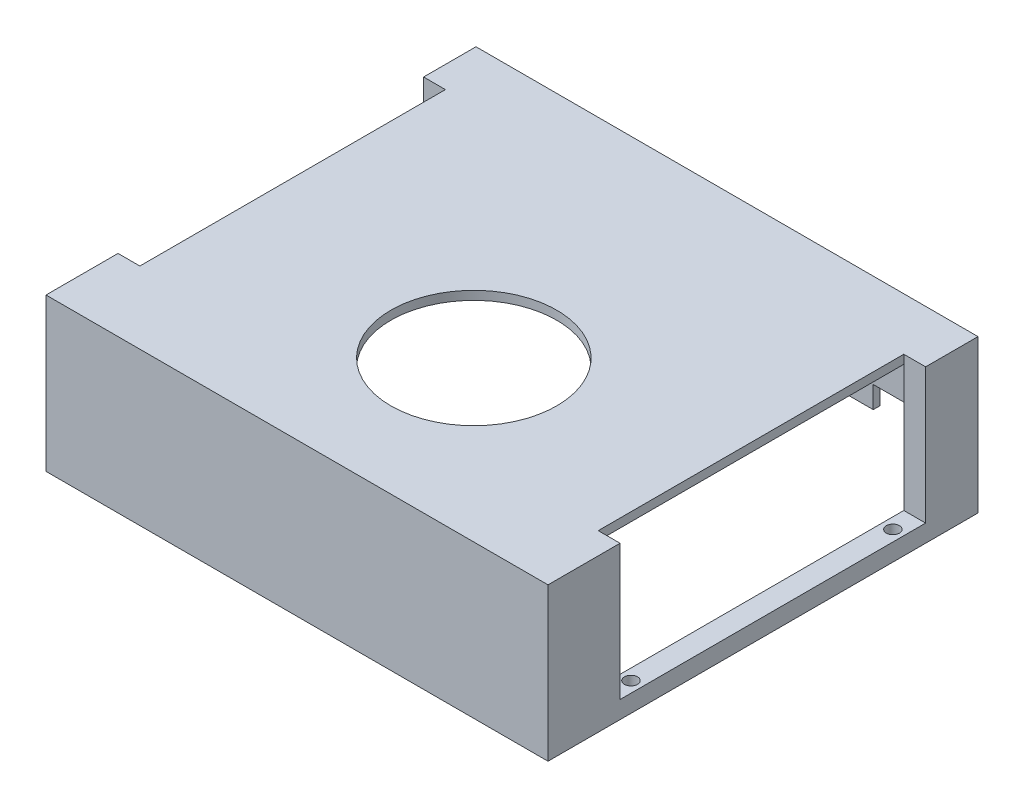
from build123d import *

# Parameters (mm, degrees)
SKETCH_1_W          = 115
SKETCH_1_H          = 98.5
EXTRUDE_1_DEPTH     = 35
SKETCH_2_W          = 105
SKETCH_2_H          = 92
CUT_EXTRUDE_1_DEPTH = 33
SKETCH_4_R          = 1.5
CUT_EXTRUDE_2_DEPTH = 3
SKETCH_4_2_R        = 1.5
CUT_EXTRUDE_3_DEPTH = 4
SKETCH_5_W          = 5
SKETCH_5_H          = 70
CUT_EXTRUDE_4_DEPTH = 31
SKETCH_6_R          = 19
CUT_EXTRUDE_5_DEPTH = 2
CUT_EXTRUDE_6_DEPTH = 2
SKETCH_6_3_R        = 19
EXTRUDE_2_DEPTH     = 2
SKETCH_6_5_R        = 19
CUT_EXTRUDE_7_DEPTH = 2


with BuildPart() as part:
    # 草图1 → 凸台-拉伸1 (new body)
    with BuildSketch(Plane(origin=(0, 0, 0), x_dir=(1, 0, 0), z_dir=(0, 1, 0))):
        with Locations((0, 7.75)):
            Rectangle(SKETCH_1_W, SKETCH_1_H)
    extrude(amount=EXTRUDE_1_DEPTH)

    # 草图2 → 切除-拉伸1 (cut)
    with BuildSketch(Plane.XZ):
        with Locations((0, -9.5)):
            Rectangle(SKETCH_2_W, SKETCH_2_H)
    extrude(amount=-CUT_EXTRUDE_1_DEPTH, mode=Mode.SUBTRACT)

    # 草图4 → 切除-拉伸2 (cut)
    with BuildSketch(Plane(origin=(0, 0, 0), x_dir=(-1, 0, 0), z_dir=(0, -1, 0))):
        with Locations((55, -20)):
            Circle(SKETCH_4_R)
        with Locations((55, 40)):
            Circle(SKETCH_4_R)
        with Locations((-55, -20)):
            Circle(SKETCH_4_R)
        with Locations((-55, 40)):
            Circle(SKETCH_4_R)
    extrude(amount=-CUT_EXTRUDE_2_DEPTH, mode=Mode.SUBTRACT)

    # 草图4<2> → 切除-拉伸3 (cut)
    with BuildSketch(Plane(origin=(0, 0, 0), x_dir=(-1, 0, 0), z_dir=(0, -1, 0))):
        with Locations((55, -20)):
            Circle(SKETCH_4_2_R)
        with Locations((55, 40)):
            Circle(SKETCH_4_2_R)
        with Locations((-55, -20)):
            Circle(SKETCH_4_2_R)
        with Locations((-55, 40)):
            Circle(SKETCH_4_2_R)
    extrude(amount=-CUT_EXTRUDE_3_DEPTH, mode=Mode.SUBTRACT)

    # 草图5 → 切除-拉伸4 (cut)
    with BuildSketch(Plane(origin=(0, 35, 0), x_dir=(1, 0, 0), z_dir=(0, 1, 0))):
        with Locations((-55, 10)):
            Rectangle(SKETCH_5_W, SKETCH_5_H)
        with Locations((55, 10)):
            Rectangle(SKETCH_5_W, SKETCH_5_H)
    extrude(amount=-CUT_EXTRUDE_4_DEPTH, mode=Mode.SUBTRACT)

    # 草图6 → 切除-拉伸5 (cut)
    with BuildSketch(Plane(origin=(0, 35, 0), x_dir=(1, 0, 0), z_dir=(0, 1, 0))):
        with Locations((4, -5)):
            Circle(SKETCH_6_R)
    extrude(amount=-CUT_EXTRUDE_5_DEPTH, mode=Mode.SUBTRACT)

    # 草图7 → 切除-拉伸6 (cut)
    with BuildSketch(Plane(origin=(0, 0, -57), x_dir=(-1, 0, 0), z_dir=(0, 0, -1))):
        Polygon((-50, 0), (50, 0), (50, 10), (36, 10), (36, 20), (-15, 20), (-15, 10), (-35, 10), (-35, 15), (-50, 15), (-50, 10), align=None)
    extrude(amount=-CUT_EXTRUDE_6_DEPTH, mode=Mode.SUBTRACT)

    # 草图6<3> → 凸台-拉伸2 (add)
    with BuildSketch(Plane(origin=(0, 35, 0), x_dir=(1, 0, 0), z_dir=(0, 1, 0))):
        with Locations((4, -5)):
            Circle(SKETCH_6_3_R)
    extrude(amount=-EXTRUDE_2_DEPTH)

    # 草图6<5> → 切除-拉伸7 (cut)
    with BuildSketch(Plane(origin=(0, 35, 0), x_dir=(1, 0, 0), z_dir=(0, 1, 0))):
        with Locations((4, -5)):
            Circle(SKETCH_6_5_R)
    extrude(amount=-CUT_EXTRUDE_7_DEPTH, mode=Mode.SUBTRACT)


solid = part.part
